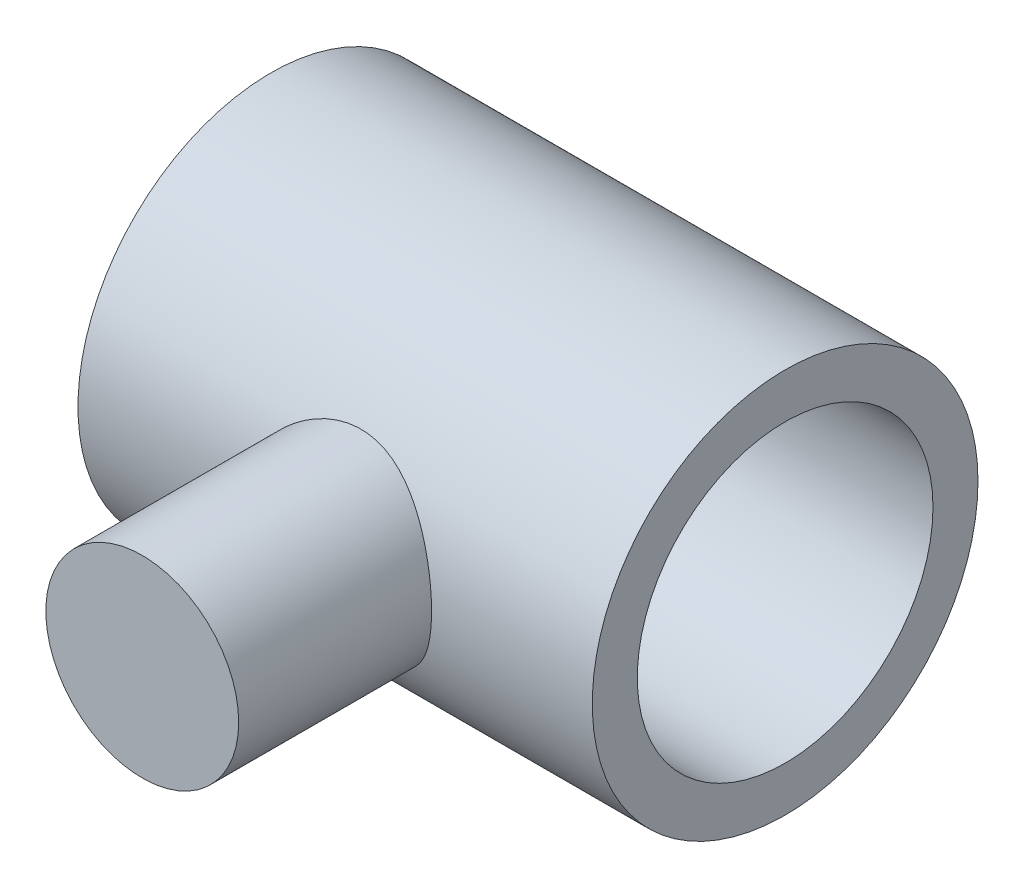
from build123d import *

# Parameters (mm, degrees)
SKETCH1_W                       = 40
SKETCH1_H                       = 3.5
SKETCH3_R                       = 7.5
BOSS_EXTRUDE1_DEPTH             = 10
BOSS_EXTRUDE1_DIRECTION_2_REACH = 45.012


with BuildPart() as part:
    # Sketch1 → Revolve1 (revolve)
    with BuildSketch(Plane.XY, mode=Mode.PRIVATE) as revolve1_sk:
        with Locations((0, 13.25)):
            Rectangle(SKETCH1_W, SKETCH1_H)
    revolve(revolve1_sk.sketch.rotate(Axis((58.178913738, 0, 0), (-1, 0, 0)), 90), axis=Axis((58.178913738, 0, 0), (-1, 0, 0)))

    # Sketch3 → Boss-Extrude1 (add)
    with BuildSketch(Plane.XY.offset(20)):
        Circle(SKETCH3_R)
    extrude(amount=BOSS_EXTRUDE1_DEPTH)

    # Sketch3 → Boss-Extrude1 direction 2 (add, up to next)
    with BuildSketch(Plane.XY.offset(20), mode=Mode.PRIVATE) as boss_extrude1_direction_2_sk1:
        Circle(SKETCH3_R)
    boss_extrude1_direction_2_tool1 = extrude(boss_extrude1_direction_2_sk1.sketch, amount=-BOSS_EXTRUDE1_DIRECTION_2_REACH, mode=Mode.PRIVATE) - part.part
    add(boss_extrude1_direction_2_tool1.solids().sort_by_distance((0, 0, 20))[0])


solid = part.part
